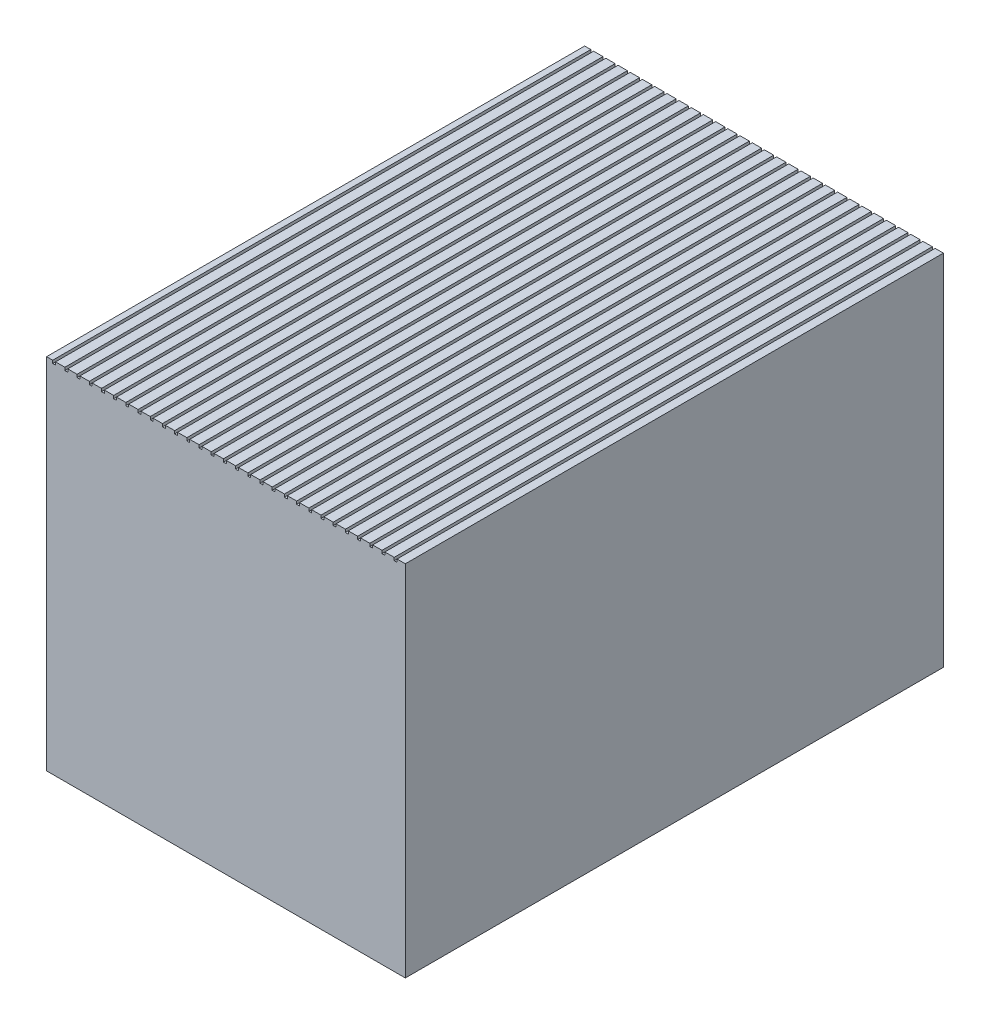
from build123d import *

# Parameters (mm, degrees)
SKETCH_2_W          = 1000
SKETCH_2_H          = 1500
EXTRUDE_1_DEPTH     = 1000
SKETCH_4_W          = 8
SKETCH_4_H          = 8
CUT_EXTRUDE_1_DEPTH = 1500


with BuildPart() as part:
    # 草图2 → 凸台-拉伸1 (new body)
    with BuildSketch(Plane(origin=(0, 0, 0), x_dir=(1, 0, 0), z_dir=(0, 1, 0))):
        Rectangle(SKETCH_2_W, SKETCH_2_H)
    extrude(amount=EXTRUDE_1_DEPTH)

    # 草图4 → 切除-拉伸1 (cut)
    with BuildSketch(Plane.XY.offset(750)):
        with Locations((-479, 996)):
            Rectangle(SKETCH_4_W, SKETCH_4_H)
        with Locations((-445, 996)):
            Rectangle(SKETCH_4_W, SKETCH_4_H)
        with Locations((-411, 996)):
            Rectangle(SKETCH_4_W, SKETCH_4_H)
        with Locations((-377, 996)):
            Rectangle(SKETCH_4_W, SKETCH_4_H)
        with Locations((-343, 996)):
            Rectangle(SKETCH_4_W, SKETCH_4_H)
        with Locations((-309, 996)):
            Rectangle(SKETCH_4_W, SKETCH_4_H)
        with Locations((-275, 996)):
            Rectangle(SKETCH_4_W, SKETCH_4_H)
        with Locations((-241, 996)):
            Rectangle(SKETCH_4_W, SKETCH_4_H)
        with Locations((-207, 996)):
            Rectangle(SKETCH_4_W, SKETCH_4_H)
        with Locations((-173, 996)):
            Rectangle(SKETCH_4_W, SKETCH_4_H)
        with Locations((-139, 996)):
            Rectangle(SKETCH_4_W, SKETCH_4_H)
        with Locations((-105, 996)):
            Rectangle(SKETCH_4_W, SKETCH_4_H)
        with Locations((-71, 996)):
            Rectangle(SKETCH_4_W, SKETCH_4_H)
        with Locations((-37, 996)):
            Rectangle(SKETCH_4_W, SKETCH_4_H)
        with Locations((-3, 996)):
            Rectangle(SKETCH_4_W, SKETCH_4_H)
        with Locations((31, 996)):
            Rectangle(SKETCH_4_W, SKETCH_4_H)
        with Locations((65, 996)):
            Rectangle(SKETCH_4_W, SKETCH_4_H)
        with Locations((99, 996)):
            Rectangle(SKETCH_4_W, SKETCH_4_H)
        with Locations((133, 996)):
            Rectangle(SKETCH_4_W, SKETCH_4_H)
        with Locations((167, 996)):
            Rectangle(SKETCH_4_W, SKETCH_4_H)
        with Locations((201, 996)):
            Rectangle(SKETCH_4_W, SKETCH_4_H)
        with Locations((235, 996)):
            Rectangle(SKETCH_4_W, SKETCH_4_H)
        with Locations((269, 996)):
            Rectangle(SKETCH_4_W, SKETCH_4_H)
        with Locations((303, 996)):
            Rectangle(SKETCH_4_W, SKETCH_4_H)
        with Locations((337, 996)):
            Rectangle(SKETCH_4_W, SKETCH_4_H)
        with Locations((371, 996)):
            Rectangle(SKETCH_4_W, SKETCH_4_H)
        with Locations((405, 996)):
            Rectangle(SKETCH_4_W, SKETCH_4_H)
        with Locations((439, 996)):
            Rectangle(SKETCH_4_W, SKETCH_4_H)
        with Locations((473, 996)):
            Rectangle(SKETCH_4_W, SKETCH_4_H)
    extrude(amount=-CUT_EXTRUDE_1_DEPTH, mode=Mode.SUBTRACT)


solid = part.part
